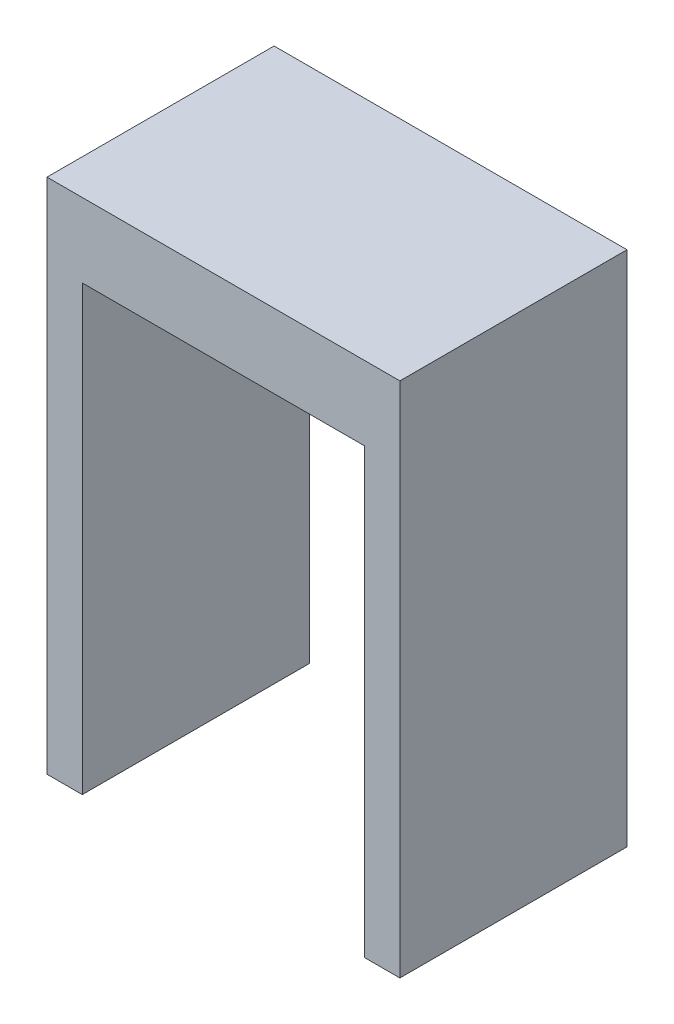
from build123d import *

# Parameters (mm, degrees)
SKETCH1_W           = 19.5
SKETCH1_H           = 26
BOSS_EXTRUDE1_DEPTH = 10
CUT_EXTRUDE1_REACH  = 21.08
SKETCH2_W           = 15.6
SKETCH2_H           = 20.8
CUT_EXTRUDE2_REACH  = 31.514
SKETCH3_R           = 1.25
CUT_EXTRUDE5_DEPTH  = 10
SKETCH8_W           = 19.5
SKETCH8_H           = 10
BOSS_EXTRUDE2_DEPTH = 1.4875
SKETCH9_W           = 15.6
SKETCH9_H           = 1.4875
SKETCH9_W_2         = 1.95
CUT_EXTRUDE7_DEPTH  = 21.123373381
SKETCH10_W          = 1.95
SKETCH10_H          = 10
BOSS_EXTRUDE3_DEPTH = 14.2875
BOSS_EXTRUDE4_DEPTH = 2.55


with BuildPart() as part:
    # Sketch1 → Boss-Extrude1 (new body)
    with BuildSketch(Plane.XY):
        Rectangle(SKETCH1_W, SKETCH1_H)
    extrude(amount=BOSS_EXTRUDE1_DEPTH)

    # Sketch2 → Cut-Extrude1 (cut, up to next)
    with BuildSketch(Plane.XY.offset(10), mode=Mode.PRIVATE) as cut_extrude1_sk1:
        Rectangle(SKETCH2_W, SKETCH2_H)
    cut_extrude1_tool1 = extrude(cut_extrude1_sk1.sketch, amount=-CUT_EXTRUDE1_REACH, mode=Mode.PRIVATE) & part.part
    add(cut_extrude1_tool1.solids().sort_by_distance((0, 0, 10))[0], mode=Mode.SUBTRACT)

    # Sketch3 → Cut-Extrude2 (cut, up to next)
    with BuildSketch(Plane.XZ.offset(13), mode=Mode.PRIVATE) as cut_extrude2_sk1:
        with Locations(Location((-5.85, 5, 0), (0, 0, 270))):
            Circle(SKETCH3_R)
    cut_extrude2_tool1 = extrude(cut_extrude2_sk1.sketch, amount=-CUT_EXTRUDE2_REACH, mode=Mode.PRIVATE) & part.part
    # Sketch3 → Cut-Extrude2 (cut, up to next)
    with BuildSketch(Plane.XZ.offset(13), mode=Mode.PRIVATE) as cut_extrude2_sk2:
        with Locations(Location((5.85, 5, 0), (0, 0, 270))):
            Circle(SKETCH3_R)
    cut_extrude2_tool2 = extrude(cut_extrude2_sk2.sketch, amount=-CUT_EXTRUDE2_REACH, mode=Mode.PRIVATE) & part.part
    add(cut_extrude2_tool1.solids().sort_by_distance((-5.85, -13, 5))[0], mode=Mode.SUBTRACT)
    add(cut_extrude2_tool2.solids().sort_by_distance((5.85, -13, 5))[0], mode=Mode.SUBTRACT)

    # Sketch6 → Cut-Extrude5 (cut)
    with BuildSketch(Plane.XY.offset(10)):
        Polygon((-7.8, -1.2875), (-9.75, -1.2875), (-9.75, -13), (9.75, -13), (9.75, -1.2875), (7.8, -1.2875), (7.8, -10.4), (-7.8, -10.4), align=None)
    extrude(amount=-CUT_EXTRUDE5_DEPTH, mode=Mode.SUBTRACT)

    # Sketch8 → Boss-Extrude2 (add)
    with BuildSketch(Plane(origin=(0, 13, 0), x_dir=(1, 0, 0), z_dir=(0, 1, 0))):
        with Locations((0, -5)):
            Rectangle(SKETCH8_W, SKETCH8_H)
    extrude(amount=BOSS_EXTRUDE2_DEPTH)

    # Sketch9 → Cut-Extrude7 (cut, through all)
    with BuildSketch(Plane.XY.offset(10)):
        with Locations((0, -0.54375)):
            Rectangle(SKETCH9_W, SKETCH9_H)
        with Locations((8.775, -0.54375)):
            Rectangle(SKETCH9_W_2, SKETCH9_H)
        with Locations((-8.775, -0.54375)):
            Rectangle(SKETCH9_W_2, SKETCH9_H)
    extrude(amount=-CUT_EXTRUDE7_DEPTH, mode=Mode.SUBTRACT)

    # Sketch10 → Boss-Extrude3 (add)
    with BuildSketch(Plane.XZ.offset(-0.2)):
        with Locations((-8.775, 5)):
            Rectangle(SKETCH10_W, SKETCH10_H)
        with Locations((8.775, 5)):
            Rectangle(SKETCH10_W, SKETCH10_H)
    extrude(amount=BOSS_EXTRUDE3_DEPTH)

    # Sketch11 → Boss-Extrude4 (add)
    with BuildSketch(Plane.XY.offset(10)):
        Polygon((-9.75, -14.0875), (-9.75, 14.4875), (9.75, 14.4875), (9.75, -14.0875), (7.8, -14.0875), (7.8, 10.4), (-7.8, 10.4), (-7.8, -14.0875), align=None)
    extrude(amount=BOSS_EXTRUDE4_DEPTH)


solid = part.part
